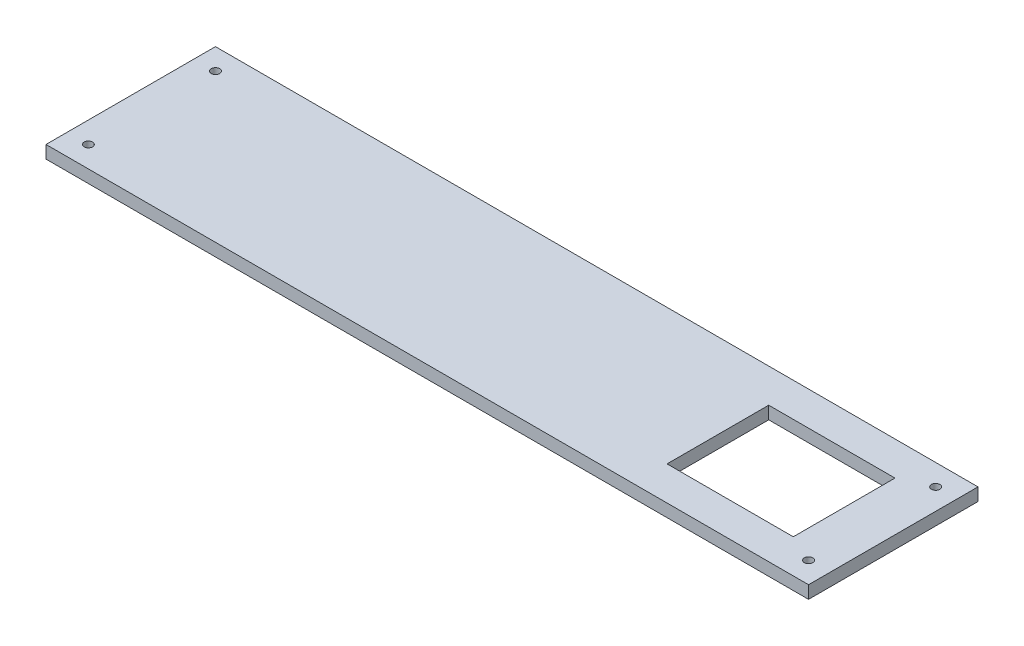
from build123d import *

# Parameters (mm, degrees)
SKETCH1_W           = 900
SKETCH1_H           = 200
SKETCH1_W_2         = 149
SKETCH1_H_2         = 120
BOSS_EXTRUDE1_DEPTH = 15
SKETCH2_R           = 5
CUT_EXTRUDE1_DEPTH  = 462.221205063


with BuildPart() as part:
    # Sketch1 → Boss-Extrude1 (new body)
    with BuildSketch(Plane(origin=(0, 0, 0), x_dir=(1, 0, 0), z_dir=(0, 1, 0))):
        Rectangle(SKETCH1_W, SKETCH1_H)
        with Locations((317.5, 0)):
            Rectangle(SKETCH1_W_2, SKETCH1_H_2, mode=Mode.SUBTRACT)
    extrude(amount=BOSS_EXTRUDE1_DEPTH)

    # Sketch2 → Cut-Extrude1 (cut, through all)
    with BuildSketch(Plane(origin=(0, 0, 0), x_dir=(1, 0, 0), z_dir=(0, 1, 0))):
        with Locations(Location((-425, 75, 0), (0, 0, 270))):
            Circle(SKETCH2_R)
        with Locations(Location((-425, -75, 0), (0, 0, 90))):
            Circle(SKETCH2_R)
        with Locations(Location((425, 75, 0), (0, 0, 90))):
            Circle(SKETCH2_R)
        with Locations(Location((425, -75, 0), (0, 0, 270))):
            Circle(SKETCH2_R)
    extrude(amount=CUT_EXTRUDE1_DEPTH, mode=Mode.SUBTRACT)


solid = part.part
